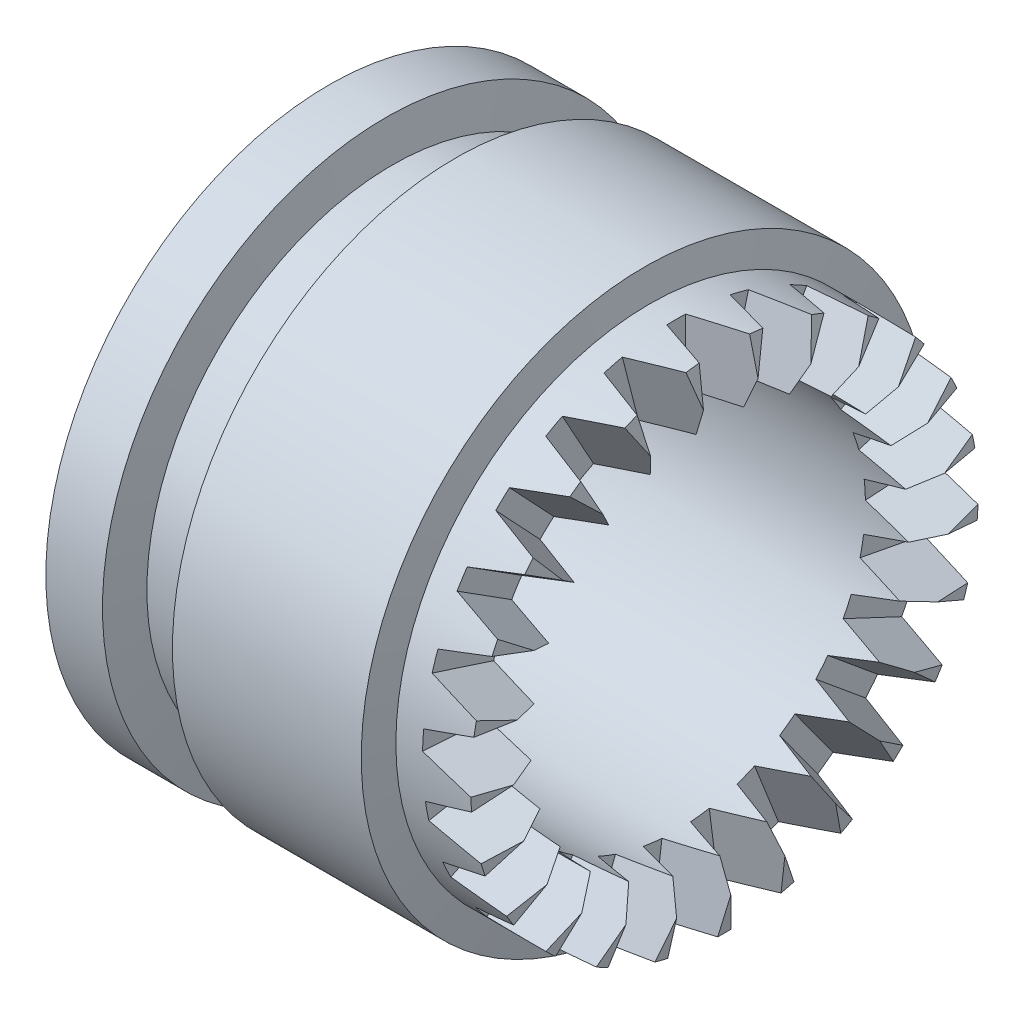
from build123d import *

# Parameters (mm, degrees)
SKETCH2_R          = 10.01706609
CUT_EXTRUDE1_DEPTH = 19
SKETCH3_R          = 12.417561257
CUT_EXTRUDE3_DEPTH = 3
CUT_EXTRUDE4_DEPTH = 4
CIRPATTERN1_COUNT  = 25


with BuildPart() as part:
    # Sketch1 → Revolve1 (revolve)
    with BuildSketch(Plane.XY, mode=Mode.PRIVATE) as revolve1_sk:
        Polygon((-31.694782465, 0), (-53.694782465, 0), (-53.694782465, 12.417561257), (-53.239428838, 15), (-50.239428838, 15), (-49.886774877, 13), (-46.886774877, 13), (-46.534120916, 15), (-36.534120916, 15), (-36.259242944, 13.44108956), (-32.298530185, 13.44108956), (-31.694782465, 10.01706609), align=None)
    revolve(revolve1_sk.sketch.rotate(Axis((-31.694782465, 0, 0), (-1, 0, 0)), 90), axis=Axis((-31.694782465, 0, 0), (-1, 0, 0)))

    # Sketch2 → Cut-Extrude1 (cut)
    with BuildSketch(Plane(origin=(-31.694782465, 0, 0), x_dir=(0, 0, -1), z_dir=(1, 0, 0))):
        Circle(SKETCH2_R)
    extrude(amount=-CUT_EXTRUDE1_DEPTH, mode=Mode.SUBTRACT)

    # Sketch3 → Cut-Extrude3 (cut)
    with BuildSketch(Plane.ZY.offset(53.694782465)):
        Circle(SKETCH3_R)
    extrude(amount=-CUT_EXTRUDE3_DEPTH, mode=Mode.SUBTRACT)

    # Sketch10 → Cut-Extrude4 (cut)
    with BuildSketch(Plane(origin=(-36.259242944, 13.44108956, 0), x_dir=(1, 0, 0), z_dir=(0, 1, 0))):
        Polygon((1.410443645, 0.5), (4.56446048, 1.531871829), (4.56446048, -1.531871829), (1.410443645, -0.5), align=None)
    cut_extrude4 = extrude(amount=-CUT_EXTRUDE4_DEPTH, mode=Mode.SUBTRACT)

    # CirPattern1: Cut-Extrude4 ×25 about axis
    cirpattern1_axis = Axis((0, 0, 0), (1, 0, 0))
    for i in range(1, CIRPATTERN1_COUNT):
        add(cut_extrude4.rotate(cirpattern1_axis, i * 360 / CIRPATTERN1_COUNT), mode=Mode.SUBTRACT)


solid = part.part
